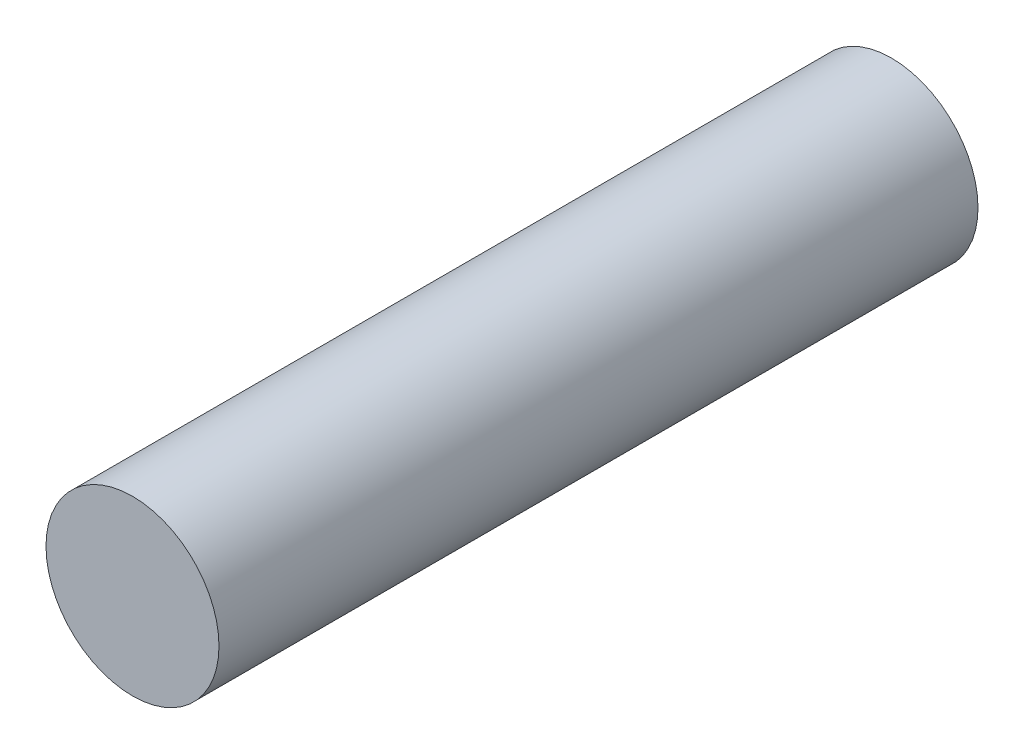
from build123d import *

# Parameters (mm, degrees)
SKETCH1_R           = 1.2
BOSS_EXTRUDE1_DEPTH = 10.53
SCALE_1_SCALE       = 2


with BuildPart() as part:
    # Sketch1 → Boss-Extrude1 (new body)
    with BuildSketch(Plane.XY):
        Circle(SKETCH1_R)
    extrude(amount=BOSS_EXTRUDE1_DEPTH)


with BuildPart() as part_1:
    # 缩放比例1: scaled about (0, 0, 5.265)
    add(part.part.scale(SCALE_1_SCALE).moved(Location((0, 0, -5.265))))


solid = part_1.part
